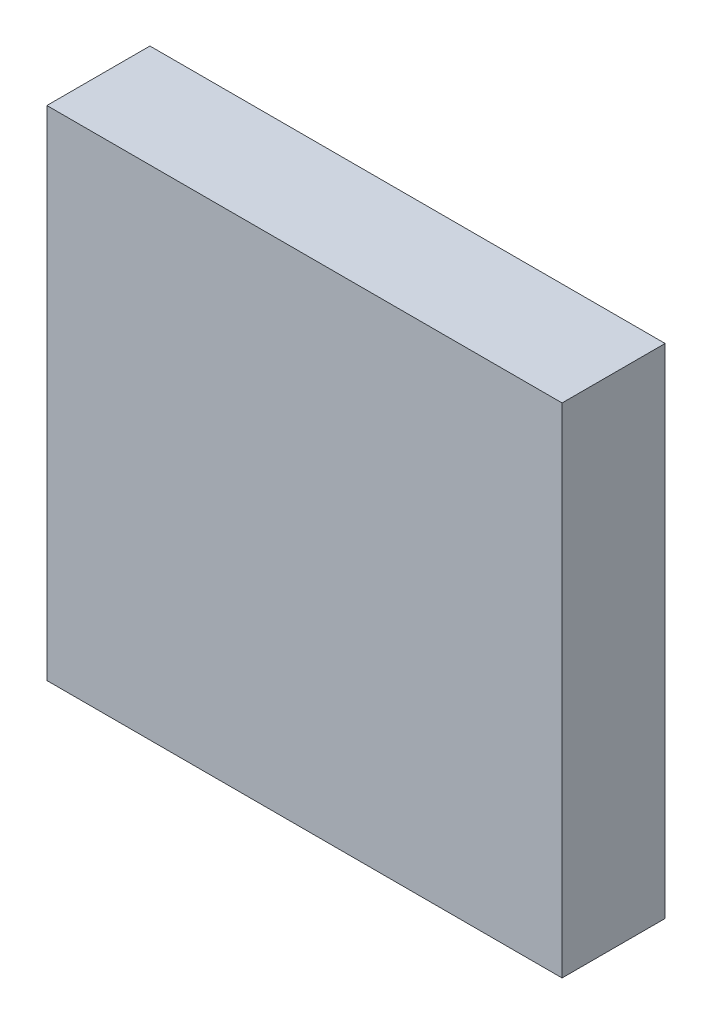
from build123d import *

# Parameters (mm, degrees)
SKETCH_1_W                                     = 60
SKETCH_1_H                                     = 58
RESERVED_60X12_INSERTION_CROSS_SECTION_1_DEPTH = 12


with BuildPart() as part:
    # Эскиз1 → Reserved_60x12_insertion_cross_section_1 (new body)
    with BuildSketch(Plane.XY.offset(6)):
        with Locations((0, 71)):
            Rectangle(SKETCH_1_W, SKETCH_1_H)
    extrude(amount=RESERVED_60X12_INSERTION_CROSS_SECTION_1_DEPTH)


solid = part.part
